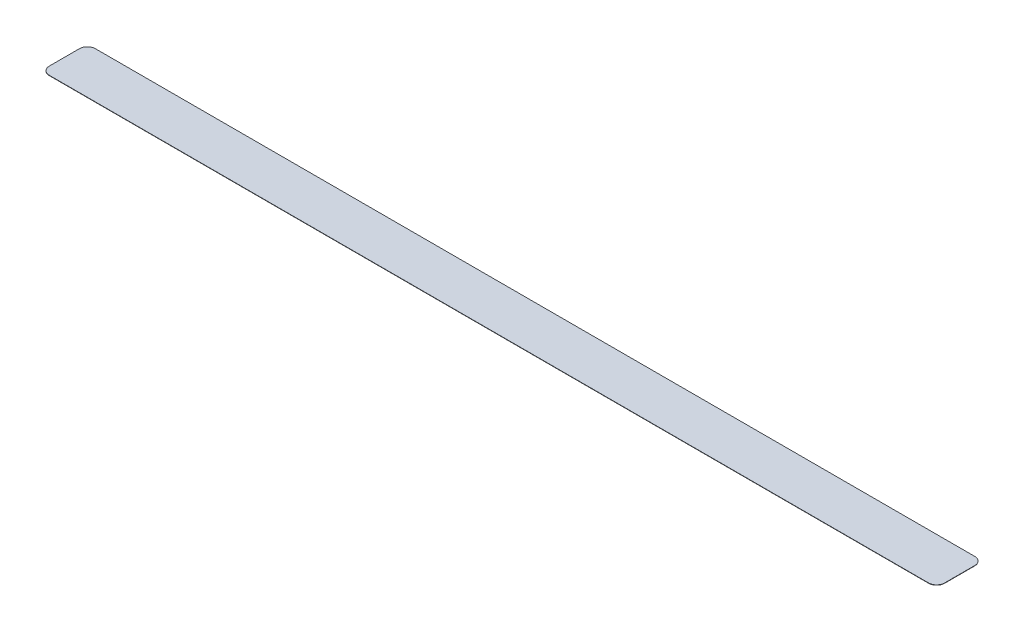
from build123d import *

# Parameters (mm, degrees)
AUFSATZ_LINEAR_AUSTRAGEN1_DEPTH = 0.1


with BuildPart() as part:
    # Skizze1 → Aufsatz-Linear austragen1 (new body)
    with BuildSketch(Plane(origin=(0, 0, 0), x_dir=(1, 0, 0), z_dir=(0, 1, 0))):
        with BuildLine():
            Line((-138.375, 7.25), (138.375, 7.25))
            ThreePointArc((138.375, 7.25), (140.142766953, 6.517766953), (140.875, 4.75))
            Line((140.875, 4.75), (140.875, -4.75))
            ThreePointArc((140.875, -4.75), (140.142766953, -6.517766953), (138.375, -7.25))
            Line((138.375, -7.25), (-138.375, -7.25))
            ThreePointArc((-138.375, -7.25), (-140.142766953, -6.517766953), (-140.875, -4.75))
            Line((-140.875, -4.75), (-140.875, 4.75))
            ThreePointArc((-140.875, 4.75), (-140.142766953, 6.517766953), (-138.375, 7.25))
        make_face()
    extrude(amount=AUFSATZ_LINEAR_AUSTRAGEN1_DEPTH)


solid = part.part
